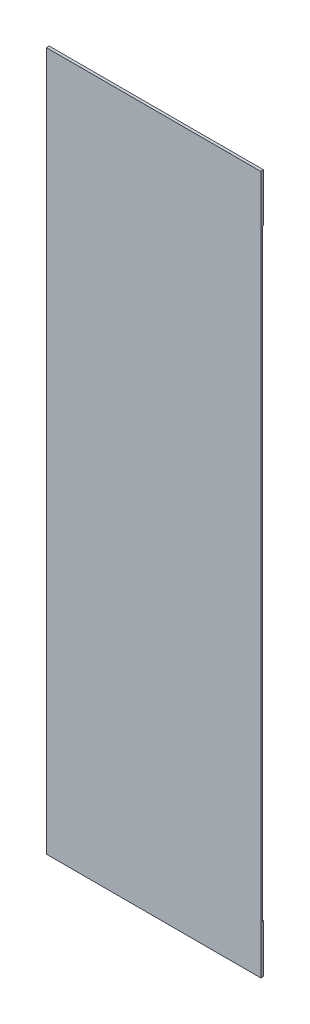
from build123d import *

# Parameters (mm, degrees)
BOSS_EXTRUDE1_DEPTH = 15.6


with BuildPart() as part:
    # Sketch2 → Boss-Extrude1 (new body)
    with BuildSketch(Plane(origin=(0, 0, 0), x_dir=(0, 0, -1), z_dir=(1, 0, 0))):
        Polygon((0.2, 47.3), (0.1, 47.3), (0.1, 3.5), (0.2, 3.5), (0.2, 0), (0, 0), (0, 3.5), (0, 47.3), (0, 50.8), (0.2, 50.8), align=None)
    extrude(amount=-BOSS_EXTRUDE1_DEPTH)


solid = part.part
